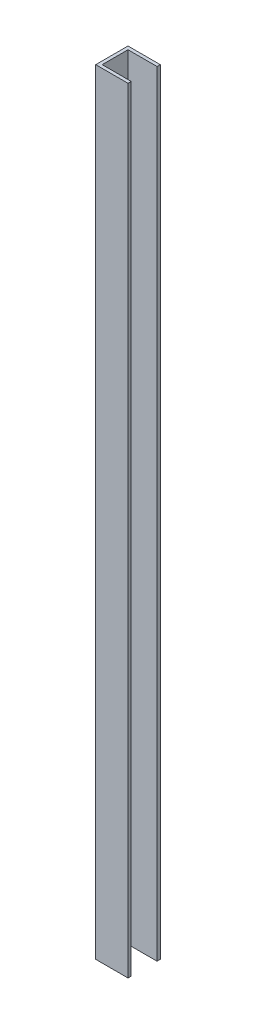
from build123d import *

# Parameters (mm, degrees)
EXTRUDE_1_DEPTH = 240


with BuildPart() as part:
    # 草图1 → 凸台-拉伸1 (new body)
    with BuildSketch(Plane(origin=(0, 0, 0), x_dir=(1, 0, 0), z_dir=(0, 1, 0))):
        Polygon((4, 4), (5, 4), (5, 5), (-5, 5), (-5, -5), (5, -5), (5, -4), (4, -4), (-4, -4), (-4, 4), align=None)
    extrude(amount=EXTRUDE_1_DEPTH)


solid = part.part
